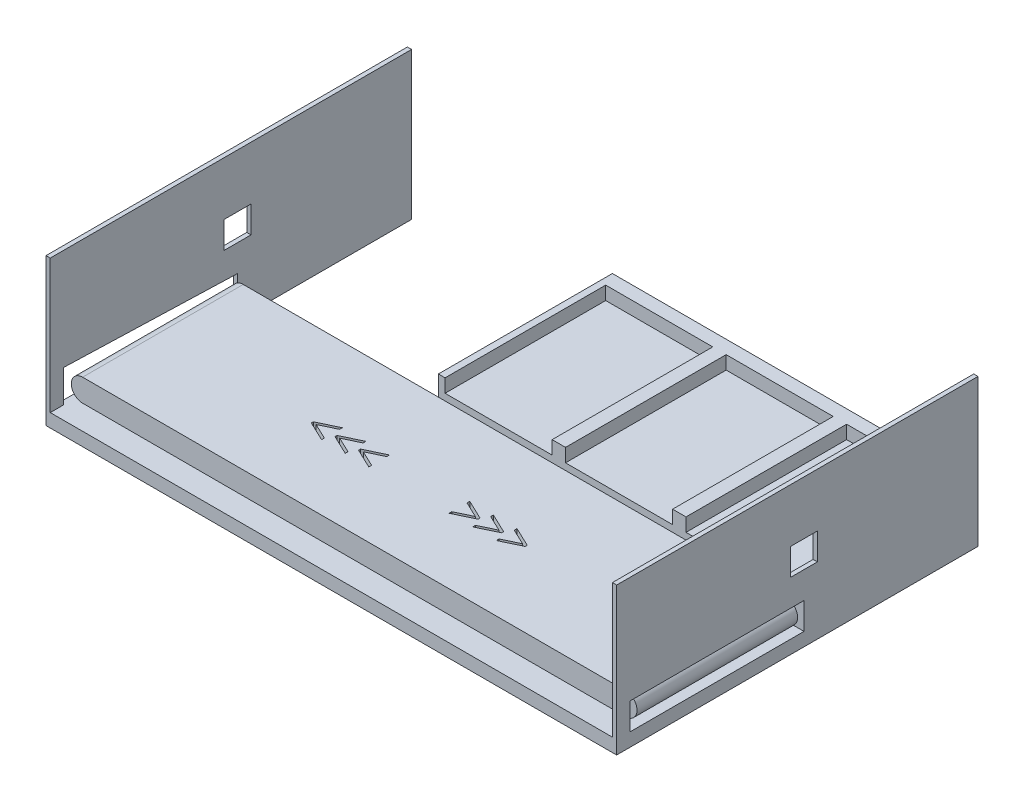
from build123d import *

# Parameters (mm, degrees)
PARKING_DEPTH       = 10
PARKINGS_COUNT      = 3
PARKINGS_PITCH      = 90
RIGHTWALL_DEPTH     = 3.175
SKETCH5_W           = 270
SKETCH5_H           = 130
PARKINGBOTTOM_DEPTH = 20
BELT_DEPTH          = 120
SIGN_DEPTH          = 16.825
FLOORBASE_DEPTH     = 10
SKETCH19_W          = 270
SKETCH19_H          = 110
LEFTWALL_DEPTH      = 3.175
SKETCH2_W           = 20
SKETCH2_H           = 20
LASERHOLE_DEPTH     = 426.35


with BuildPart() as part:
    # SingleLot → Parking (new body)
    with BuildSketch(Plane(origin=(0, 0, 0), x_dir=(1, 0, 0), z_dir=(0, 1, 0))):
        Polygon((5, 70), (0, 70), (0, 200), (90, 200), (90, 70), (85, 70), (85, 190), (5, 190), align=None)
    parking = extrude(amount=PARKING_DEPTH)

    # Parkings: Parking ×3
    with Locations(*[(i * PARKINGS_PITCH, 0, 0) for i in range(1, PARKINGS_COUNT)]):
        add(parking)

    # Wall → RightWall (add)
    with BuildSketch(Plane(origin=(270, 0, 0), x_dir=(0, 0, -1), z_dir=(1, 0, 0))):
        Polygon((-70, 80), (200, 80), (200, 0), (200, -20), (70, -20), (70, 0), (-60, 0), (-60, -20), (-70, -20), align=None)
    extrude(amount=RIGHTWALL_DEPTH)

    # Sketch5 → ParkingBottom (add)
    with BuildSketch(Plane.XZ):
        with Locations((135, -135)):
            Rectangle(SKETCH5_W, SKETCH5_H)
    extrude(amount=PARKINGBOTTOM_DEPTH)

    # Sketch17 → FloorBase (add)
    with BuildSketch(Plane.XZ.offset(20)):
        Polygon((0, -200), (273.175, -200), (273.175, 70), (-150, 70), (-150, -70), (0, -70), align=None)
    extrude(amount=FLOORBASE_DEPTH)

    # Sketch19 → LeftWall (add)
    with BuildSketch(Plane.ZY.offset(150)):
        with Locations((-65, 25)):
            Rectangle(SKETCH19_W, SKETCH19_H)
        Polygon((60, -20), (60, 4.202967169), (-70, 0), (-70, -20), align=None, mode=Mode.SUBTRACT)
    extrude(amount=LEFTWALL_DEPTH)

    # Sketch2 → LaserHole (cut)
    with BuildSketch(Plane(origin=(273.175, 0, 0), x_dir=(0, 0, -1), z_dir=(1, 0, 0))):
        with Locations((70, 30)):
            Rectangle(SKETCH2_W, SKETCH2_H)
    extrude(amount=-LASERHOLE_DEPTH, mode=Mode.SUBTRACT)


with BuildPart() as body_2:
    # Sketch15 → Belt (new body)
    with BuildSketch(Plane.XY.offset(-65)):
        with BuildLine():
            Line((-140.825, 0), (265, 0))
            ThreePointArc((265, 0), (273.4125, -8.4125), (265, -16.825))
            Line((265, -16.825), (-140.825, -16.825))
            ThreePointArc((-140.825, -16.825), (-149.2375, -8.4125), (-140.825, 0))
        make_face()
    extrude(amount=BELT_DEPTH)

    # Sketch16 → <<>>Sign (cut)
    with BuildSketch(Plane(origin=(0, 0, 0), x_dir=(1, 0, 0), z_dir=(0, 1, 0))):
        Polygon((-11.098872594, -4.068968491), (-11.098872594, -6.155106312), (-25.752718748, 0.815646893), (-25.752718748, 2.342089201), (-11.098872594, 9.312842406), (-11.098872594, 7.226704586), (-22.975441771, 1.578868047), align=None)
        Polygon((6.540016295, -4.068968491), (6.540016295, -6.155106312), (-8.113829859, 0.815646893), (-8.113829859, 2.342089201), (6.540016295, 9.312842406), (6.540016295, 7.226704586), (-5.336552882, 1.578868047), align=None)
        Polygon((24.178905184, -4.068968491), (24.178905184, -6.155106312), (9.52505903, 0.815646893), (9.52505903, 2.342089201), (24.178905184, 9.312842406), (24.178905184, 7.226704586), (12.302336007, 1.578868047), align=None)
        Polygon((84.151127406, -4.090169079), (96.031936701, 1.578868047), (84.151127406, 7.247905173), (84.151127406, 9.312842406), (98.80497356, 2.320888613), (98.80497356, 0.836847481), (84.151127406, -6.155106312), align=None)
        Polygon((101.790016295, -4.090169079), (113.67082559, 1.578868047), (101.790016295, 7.247905173), (101.790016295, 9.312842406), (116.443862449, 2.320888613), (116.443862449, 0.836847481), (101.790016295, -6.155106312), align=None)
        Polygon((119.428905184, -4.090169079), (131.309714479, 1.578868047), (119.428905184, 7.247905173), (119.428905184, 9.312842406), (134.082751338, 2.320888613), (134.082751338, 0.836847481), (119.428905184, -6.155106312), align=None)
    extrude(amount=-SIGN_DEPTH, mode=Mode.SUBTRACT)


solid = Compound([part.part, body_2.part])
